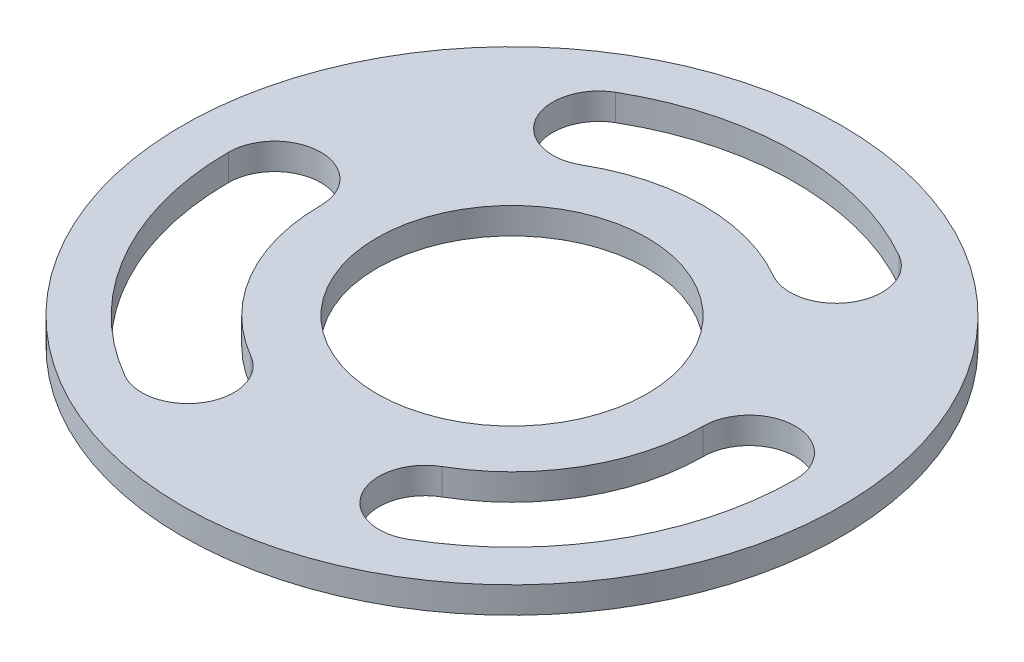
from build123d import *

# Parameters (mm, degrees)
CROQUIS1_R              = 12.5
CROQUIS1_R_2            = 5.125
SALIENTE_EXTRUIR1_DEPTH = 1


with BuildPart() as part:
    # Croquis1 → Saliente-Extruir1 (new body)
    with BuildSketch(Plane(origin=(0, 0, 0), x_dir=(1, 0, 0), z_dir=(0, 1, 0))):
        with Locations(Location((0, 0, 0), (0, 0, 270))):
            Circle(CROQUIS1_R)
        with Locations(Location((0, 0, 0), (0, 0, 270))):
            Circle(CROQUIS1_R_2, mode=Mode.SUBTRACT)
        with BuildLine():
            ThreePointArc((5.375, 9.309773091), (0, 10.75), (-5.375, 9.309773091))
            ThreePointArc((-5.375, 9.309773091), (-6.015544457, 6.919228634), (-3.625, 6.278684177))
            ThreePointArc((-3.625, 6.278684177), (0, 7.25), (3.625, 6.278684177))
            ThreePointArc((3.625, 6.278684177), (6.015544457, 6.919228634), (5.375, 9.309773091))
        make_face(mode=Mode.SUBTRACT)
        with BuildLine():
            ThreePointArc((5.375, -9.309773091), (9.309773091, -5.375), (10.75, 0))
            ThreePointArc((10.75, 0), (9, 1.75), (7.25, 0))
            ThreePointArc((7.25, 0), (6.278684177, -3.625), (3.625, -6.278684177))
            ThreePointArc((3.625, -6.278684177), (2.984455543, -8.669228634), (5.375, -9.309773091))
        make_face(mode=Mode.SUBTRACT)
        with BuildLine():
            ThreePointArc((-10.75, 0), (-9.309773091, -5.375), (-5.375, -9.309773091))
            ThreePointArc((-5.375, -9.309773091), (-2.984455543, -8.669228634), (-3.625, -6.278684177))
            ThreePointArc((-3.625, -6.278684177), (-6.278684177, -3.625), (-7.25, 0))
            ThreePointArc((-7.25, 0), (-9, 1.75), (-10.75, 0))
        make_face(mode=Mode.SUBTRACT)
    extrude(amount=SALIENTE_EXTRUIR1_DEPTH)


solid = part.part
